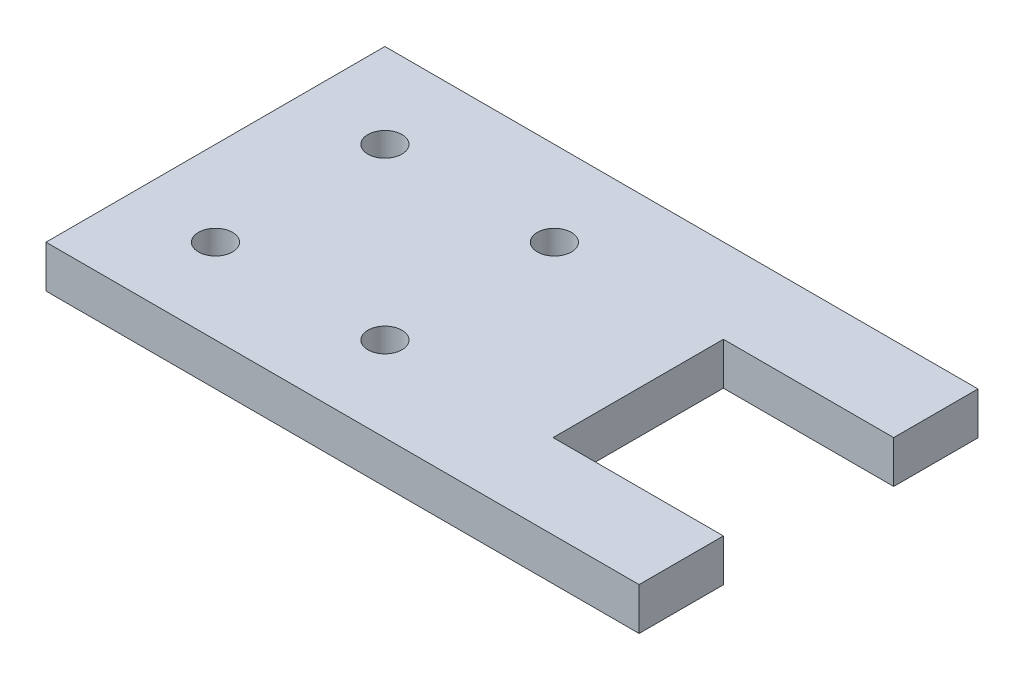
from build123d import *

# Parameters (mm, degrees)
BOSS_EXTRUDE1_DEPTH    = 6.35
F_10_CLEARANCE_HOLE1_D = 5.1054
SKETCH5_W              = 25.527
SKETCH5_H              = 25.527
CUT_EXTRUDE1_DEPTH     = 63.861792847


with BuildPart() as part:
    # Sketch1 → Boss-Extrude1 (new body)
    with BuildSketch(Plane(origin=(0, 0, 0), x_dir=(1, 0, 0), z_dir=(0, 1, 0))):
        Polygon((31.75, 25.4), (57.15, 25.4), (57.15, -25.4), (31.75, -25.4), (-31.75, -25.4), (-31.75, 25.4), align=None)
    extrude(amount=BOSS_EXTRUDE1_DEPTH)

    # #10 Clearance Hole1 (through all)
    with Locations(Plane(origin=(0, 6.35, 0), x_dir=(1, 0, 0), z_dir=(0, 1, 0))):
        with Locations((-19.05, 12.7), (6.35, 12.7), (6.35, -12.7), (-19.05, -12.7)):
            Hole(F_10_CLEARANCE_HOLE1_D / 2)

    # Sketch5 → Cut-Extrude1 (cut, through all)
    with BuildSketch(Plane(origin=(0, 6.35, 0), x_dir=(1, 0, 0), z_dir=(0, 1, 0))):
        with Locations((44.3865, 0)):
            Rectangle(SKETCH5_W, SKETCH5_H)
    extrude(amount=-CUT_EXTRUDE1_DEPTH, mode=Mode.SUBTRACT)


solid = part.part
